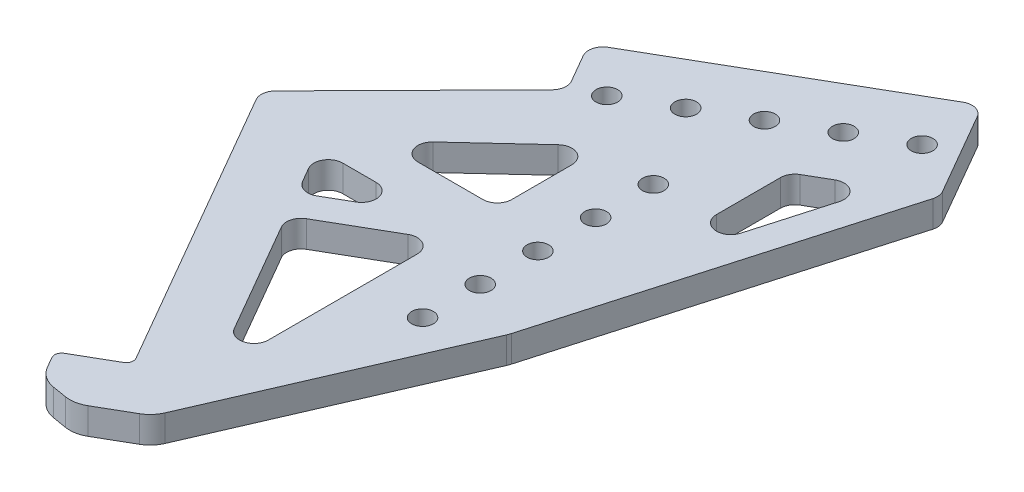
from build123d import *

# Parameters (mm, degrees)
SKETCH1_R           = 2.38125
BOSS_EXTRUDE1_DEPTH = 5.842
FILLET1_R           = 3.175
FILLET2_R           = 3.175
FILLET3_R           = 1.5875
FILLET5_R           = 6.35


with BuildPart() as part:
    # Sketch1 → Boss-Extrude1 (new body)
    with BuildSketch(Plane(origin=(0, 0, 0), x_dir=(1, 0, 0), z_dir=(0, 1, 0))):
        Polygon((-11.01238397, -123.675577549), (12.699883629, -68.919434524), (33.84630657, 4.876477372), (21.14630657, 26.873522628), (-33.84630657, -4.876477372), (-27.49630657, -15.875), (-61.093499563, -49.937045256), (-22.993499563, -115.928181024), (-33.992022192, -122.278181024), (-30.325847982, -128.628181024), (-22.010906598, -130.025577549), align=None)
        with Locations(Location((21.997045256, 12.7, 0), (0, 0, 270))):
            Circle(SKETCH1_R, mode=Mode.SUBTRACT)
        with Locations(Location((10.998522628, 6.35, 0), (0, 0, 270))):
            Circle(SKETCH1_R, mode=Mode.SUBTRACT)
        with Locations(Location((0, 0, 0), (0, 0, 270))):
            Circle(SKETCH1_R, mode=Mode.SUBTRACT)
        with Locations(Location((-10.998522628, -6.35, 0), (0, 0, 270))):
            Circle(SKETCH1_R, mode=Mode.SUBTRACT)
        with Locations(Location((-21.997045256, -12.7, 0), (0, 0, 270))):
            Circle(SKETCH1_R, mode=Mode.SUBTRACT)
        with Locations(Location((0, -24.4695218, 0), (0, 0, 270))):
            Circle(SKETCH1_R, mode=Mode.SUBTRACT)
        with Locations(Location((0, -37.1695218, 0), (0, 0, 270))):
            Circle(SKETCH1_R, mode=Mode.SUBTRACT)
        with Locations(Location((0, -49.8695218, 0), (0, 0, 270))):
            Circle(SKETCH1_R, mode=Mode.SUBTRACT)
        with Locations(Location((0, -62.5695218, 0), (0, 0, 270))):
            Circle(SKETCH1_R, mode=Mode.SUBTRACT)
        with Locations(Location((0, -75.2695218, 0), (0, 0, 270))):
            Circle(SKETCH1_R, mode=Mode.SUBTRACT)
        Polygon((25.931282224, 0.306735935), (12.7, -7.332348419), (12.7, -16.277642723), (12.7, -45.867554067), align=None, mode=Mode.SUBTRACT)
        Polygon((-43.744976935, -54.585567884), (-37.571232702, -65.27880657), (-19.05, -54.585567884), align=None, mode=Mode.SUBTRACT)
        Polygon((-12.7, -22.427495922), (-12.7, -46.106477151), (-18.344976935, -46.106477151), (-38.267154833, -46.106477151), (-18.344976935, -27.655582651), align=None, mode=Mode.SUBTRACT)
        Polygon((-18.344976935, -98.579658396), (-12.7, -108.357045256), (-12.7, -101.6), (-12.7, -58.251742094), (-34.396232702, -70.778067884), align=None, mode=Mode.SUBTRACT)
    extrude(amount=BOSS_EXTRUDE1_DEPTH)

    # Fillet1
    fillet1_edges = [part.edges().sort_by_distance(p)[0] for p in [
        (-19.05, 2.921, 54.585567884),
        (-43.744976935, 2.921, 54.585567884),
        (-37.571232702, 2.921, 65.27880657),
        (12.7, 2.921, 7.332348419),
        (12.7, 2.921, 45.867554067),
        (25.931282224, 2.921, -0.306735935),
        (-34.396232702, 2.921, 70.778067884),
        (-12.7, 2.921, 108.357045256),
        (-12.7, 2.921, 58.251742094),
        (-12.7, 2.921, 46.106477151),
        (-12.7, 2.921, 22.427495922),
        (-38.267154833, 2.921, 46.106477151),
    ]]
    fillet(fillet1_edges, radius=FILLET1_R)

    # Fillet2
    fillet2_edges = [part.edges().sort_by_distance(p)[0] for p in [
        (-33.84630657, 2.921, 4.876477372),
        (21.14630657, 2.921, -26.873522628),
        (33.84630657, 2.921, -4.876477372),
        (-61.093499563, 2.921, 49.937045256),
        (-27.49630657, 2.921, 15.875),
    ]]
    fillet(fillet2_edges, radius=FILLET2_R)

    # Fillet3
    fillet3_edges = [part.edges().sort_by_distance(p)[0] for p in [
        (-33.992022192, 2.921, 122.278181024),
        (-22.993499563, 2.921, 115.928181024),
    ]]
    fillet(fillet3_edges, radius=FILLET3_R)

    # Fillet5
    fillet5_edges = [part.edges().sort_by_distance(p)[0] for p in [
        (12.699883629, 2.921, 68.919434524),
        (-11.01238397, 2.921, 123.675577549),
        (-22.010906598, 2.921, 130.025577549),
        (-30.325847982, 2.921, 128.628181024),
    ]]
    fillet(fillet5_edges, radius=FILLET5_R)


solid = part.part
